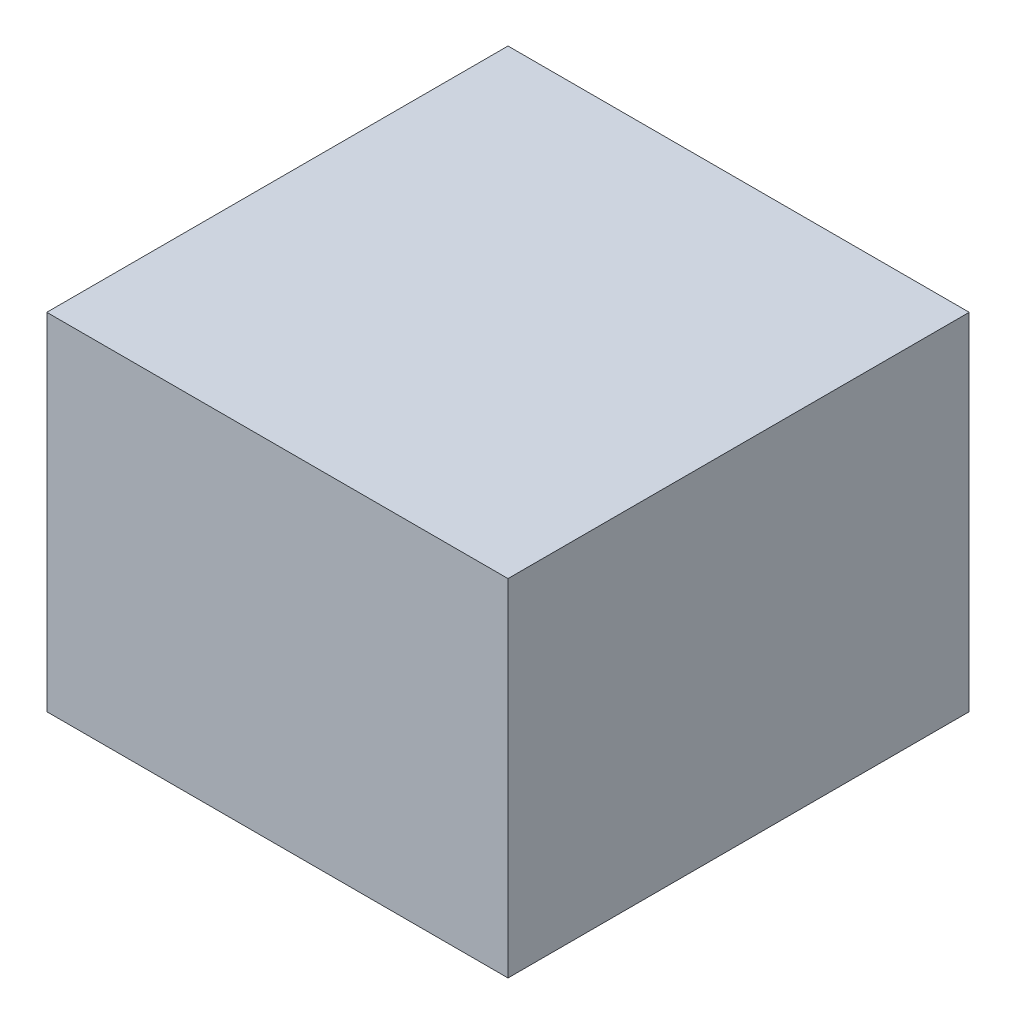
from build123d import *

# Parameters (mm, degrees)
OVEN_SICAK_DOLAP_TERMOSTAT_1_START = -340
SKETCH1_W                          = 40
SKETCH1_H                          = 30
OVEN_SICAK_DOLAP_TERMOSTAT_1_DEPTH = 40


with BuildPart() as part:
    # Sketch1 → OVEN_sicak_dolap_termostat_1 (new body)
    with BuildSketch(Plane.XY.offset(OVEN_SICAK_DOLAP_TERMOSTAT_1_START)):
        with Locations((440, 877)):
            Rectangle(SKETCH1_W, SKETCH1_H)
    extrude(amount=-OVEN_SICAK_DOLAP_TERMOSTAT_1_DEPTH)


solid = part.part
